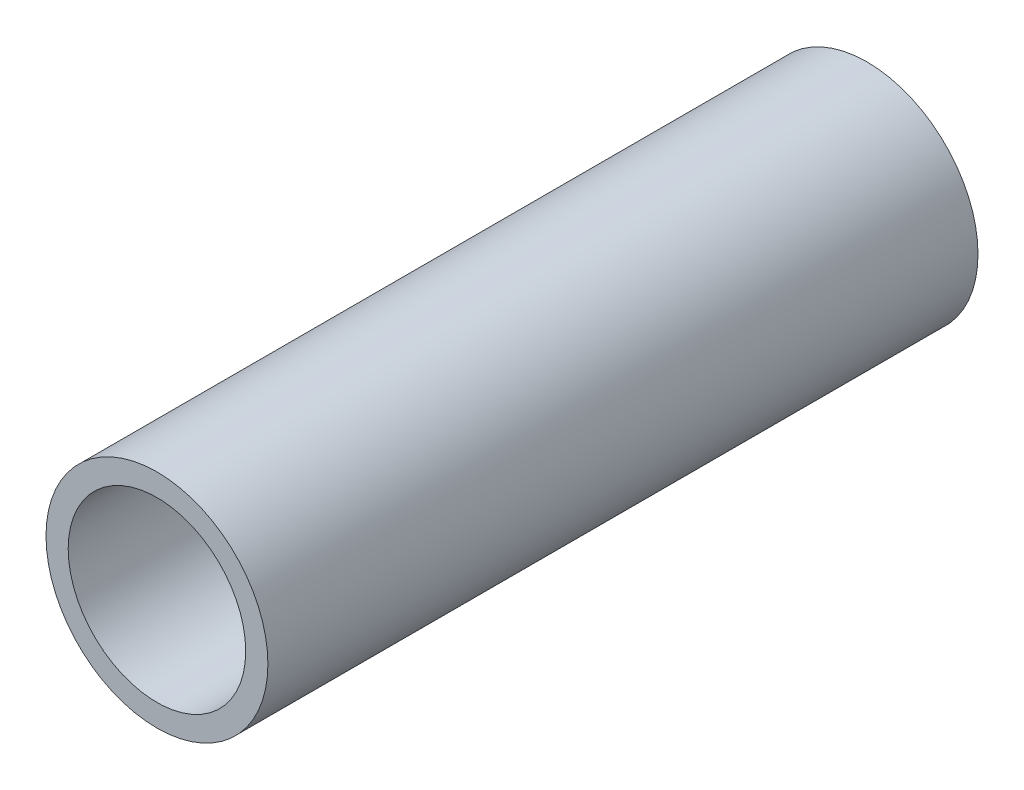
from build123d import *

# Parameters (mm, degrees)
SKETCH1_R           = 3.96875
SKETCH1_R_2         = 3.175
BOSS_EXTRUDE1_DEPTH = 25.4


with BuildPart() as part:
    # Sketch1 → Boss-Extrude1 (new body)
    with BuildSketch(Plane.XY):
        Circle(SKETCH1_R)
        Circle(SKETCH1_R_2, mode=Mode.SUBTRACT)
    extrude(amount=BOSS_EXTRUDE1_DEPTH)


solid = part.part
